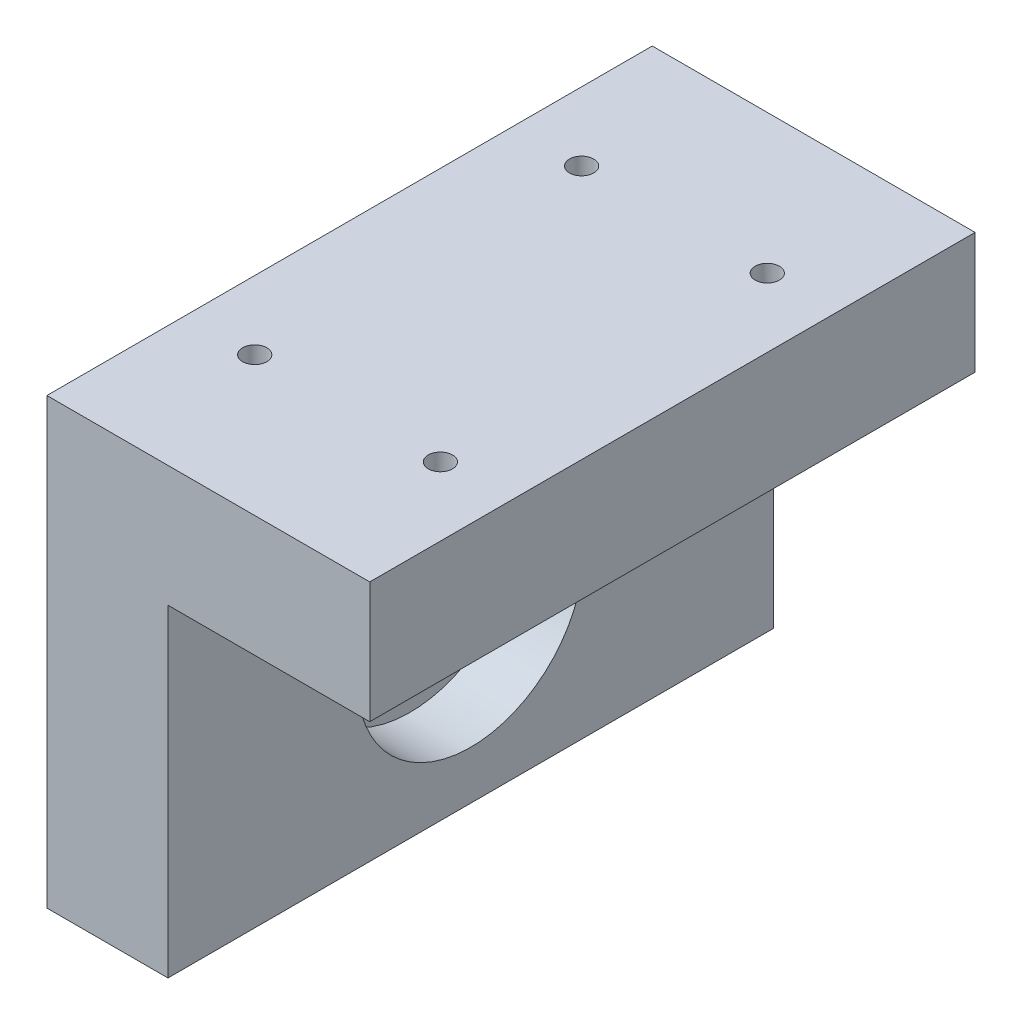
from build123d import *

# Parameters (mm, degrees)
SKETCH1_W           = 75
SKETCH1_H           = 40
SKETCH1_R           = 14
BOSS_EXTRUDE1_DEPTH = 15
SKETCH1_3_R         = 14
SKETCH1_3_R_2       = 3
BOSS_EXTRUDE2_DEPTH = 7.5
SKETCH3_W           = 40
SKETCH3_H           = 75
SKETCH3_R           = 1.5
BOSS_EXTRUDE3_DEPTH = 15


with BuildPart() as part:
    # Sketch1 → Boss-Extrude1 (new body)
    with BuildSketch(Plane(origin=(0, 0, 0), x_dir=(0, 0, -1), z_dir=(1, 0, 0))):
        with Locations((-37.5, 20)):
            Rectangle(SKETCH1_W, SKETCH1_H)
        with Locations((-37.5, 20)):
            Circle(SKETCH1_R, mode=Mode.SUBTRACT)
    extrude(amount=BOSS_EXTRUDE1_DEPTH)

    # Sketch1<3> → Boss-Extrude2 (add)
    with BuildSketch(Plane(origin=(0, 0, 0), x_dir=(0, 0, -1), z_dir=(1, 0, 0))):
        with Locations((-37.5, 20)):
            Circle(SKETCH1_3_R)
        with Locations((-37.5, 20)):
            Circle(SKETCH1_3_R_2, mode=Mode.SUBTRACT)
    extrude(amount=BOSS_EXTRUDE2_DEPTH)

    # Sketch3 → Boss-Extrude3 (add)
    with BuildSketch(Plane(origin=(0, 40, 0), x_dir=(1, 0, 0), z_dir=(0, 1, 0))):
        with Locations((20, -37.5)):
            Rectangle(SKETCH3_W, SKETCH3_H)
        with Locations((8.5, -17.25)):
            Circle(SKETCH3_R, mode=Mode.SUBTRACT)
        with Locations((31.5, -17.25)):
            Circle(SKETCH3_R, mode=Mode.SUBTRACT)
        with Locations((31.5, -57.75)):
            Circle(SKETCH3_R, mode=Mode.SUBTRACT)
        with Locations((8.5, -57.75)):
            Circle(SKETCH3_R, mode=Mode.SUBTRACT)
    extrude(amount=BOSS_EXTRUDE3_DEPTH)


solid = part.part
